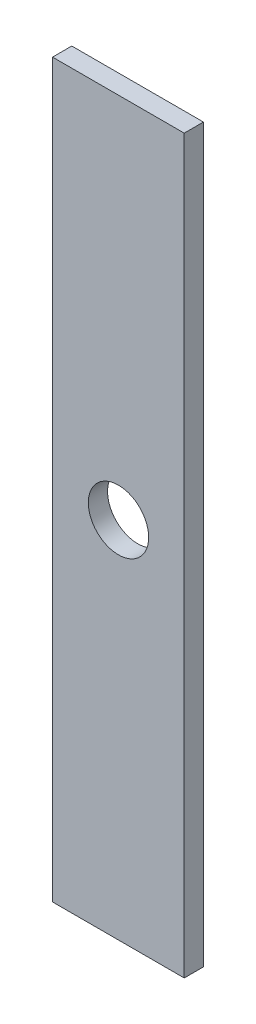
from build123d import *

# Parameters (mm, degrees)
SKETCH1_W           = 76.2
SKETCH1_H           = 423.418
BOSS_EXTRUDE1_DEPTH = 11.1252
SKETCH5_R           = 17.4625
CUT_EXTRUDE1_DEPTH  = 216.397494777


with BuildPart() as part:
    # Sketch1 → Boss-Extrude1 (new body)
    with BuildSketch(Plane.XY):
        Rectangle(SKETCH1_W, SKETCH1_H)
    extrude(amount=BOSS_EXTRUDE1_DEPTH)

    # Sketch5 → Cut-Extrude1 (cut, through all)
    with BuildSketch(Plane.XY.offset(11.1252)):
        with Locations((0.0635, -1.2065)):
            Circle(SKETCH5_R)
    extrude(amount=-CUT_EXTRUDE1_DEPTH, mode=Mode.SUBTRACT)


solid = part.part
